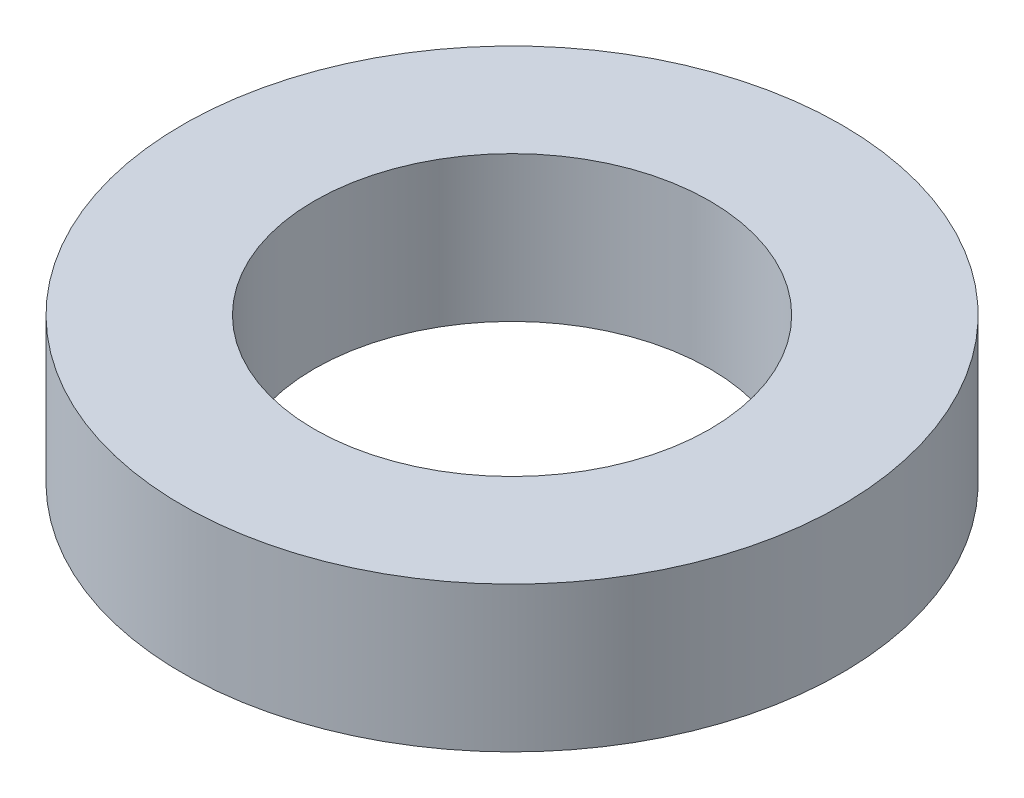
from build123d import *

# Parameters (mm, degrees)
SKETCH1_R           = 7.9375
SKETCH1_R_2         = 4.7625
BOSS_EXTRUDE1_DEPTH = 3.5


with BuildPart() as part:
    # Sketch1 → Boss-Extrude1 (new body)
    with BuildSketch(Plane(origin=(0, 0, 0), x_dir=(1, 0, 0), z_dir=(0, 1, 0))):
        with Locations(Location((0, 0, 0), (0, 0, 90))):
            Circle(SKETCH1_R)
        with Locations(Location((0, 0, 0), (0, 0, 90))):
            Circle(SKETCH1_R_2, mode=Mode.SUBTRACT)
    extrude(amount=BOSS_EXTRUDE1_DEPTH)


solid = part.part
